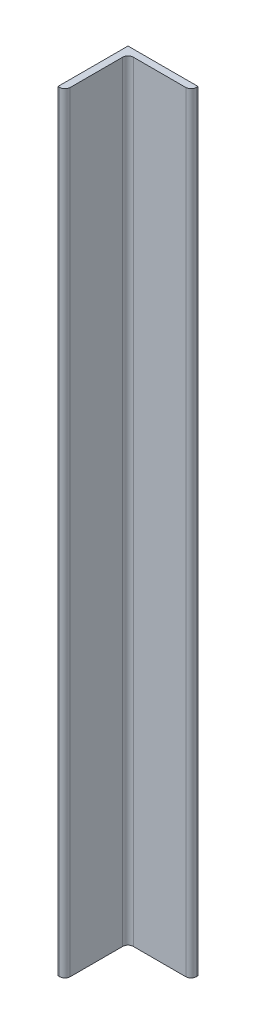
from build123d import *

# Parameters (mm, degrees)
BOSS_EXTRUDE1_DEPTH = 440


with BuildPart() as part:
    # Sketch1 → Boss-Extrude1 (new body)
    with BuildSketch(Plane(origin=(0, 0, 0), x_dir=(1, 0, 0), z_dir=(0, 1, 0))):
        with BuildLine():
            Line((-27.499872145, 29.213153277), (-67.499872145, 29.213153277))
            Line((-67.499872145, 29.213153277), (-67.499872145, -10.786846723))
            Line((-67.499872145, -10.786846723), (-66.499872145, -10.786846723))
            ThreePointArc((-66.499872145, -10.786846723), (-64.378551801, -9.908167067), (-63.499872145, -7.786846723))
            Line((-63.499872145, -7.786846723), (-63.499872145, 22.213153277))
            ThreePointArc((-63.499872145, 22.213153277), (-62.621192489, 24.334473621), (-60.499872145, 25.213153277))
            Line((-60.499872145, 25.213153277), (-30.499872145, 25.213153277))
            ThreePointArc((-30.499872145, 25.213153277), (-28.378551801, 26.091832933), (-27.499872145, 28.213153277))
            Line((-27.499872145, 28.213153277), (-27.499872145, 29.213153277))
        make_face()
    extrude(amount=BOSS_EXTRUDE1_DEPTH)


solid = part.part
